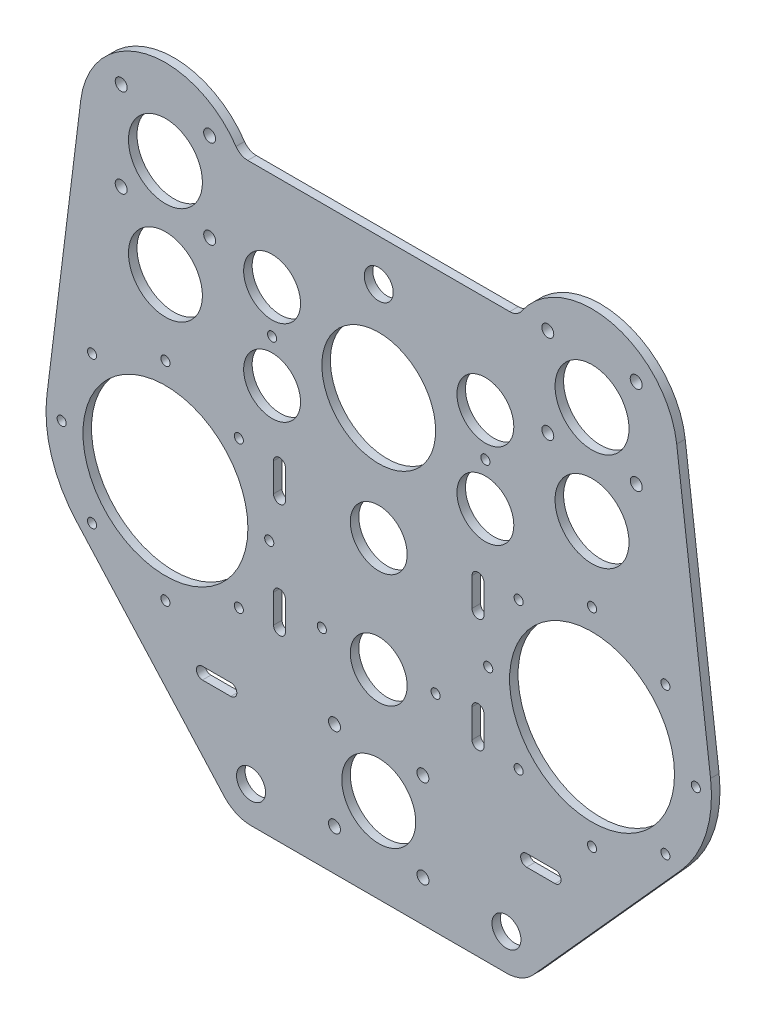
from build123d import *

# Parameters (mm, degrees)
MODEL_R             = 13
MODEL_R_2           = 5.1
MODEL_R_3           = 10
MODEL_R_4           = 20
MODEL_R_5           = 29
MODEL_R_6           = 1.6
MODEL_R_7           = 2.1
BOSS_EXTRUDE1_DEPTH = 3
CUT_EXTRUDE1_REACH  = 162.618
SKETCH1_R           = 1.6


with BuildPart() as part:
    # Model → Boss-Extrude1 (new body)
    with BuildSketch(Plane.XY):
        with BuildLine():
            Line((-44.9, -110), (0, -110))
            Line((0, -110), (44.9, -110))
            ThreePointArc((44.9, -110), (50.059264201, -108.902545418), (54.325169295, -105.800212848))
            Line((54.325169295, -105.800212848), (106.229152519, -48.084515893))
            ThreePointArc((106.229152519, -48.084515893), (115.069026633, -32.588610118), (116.679519982, -14.821427412))
            Line((116.679519982, -14.821427412), (104.771085702, 81.023096559))
            ThreePointArc((104.771085702, 81.023096559), (82.034748438, 106.48766041), (50.189310486, 94.189159448))
            ThreePointArc((50.189310486, 94.189159448), (48.393618278, 92.581052005), (46.054195567, 92))
            Line((46.054195567, 92), (0, 92))
            Line((0, 92), (-46.054195567, 92))
            ThreePointArc((-46.054195567, 92), (-48.393618278, 92.581052005), (-50.189310486, 94.189159448))
            ThreePointArc((-50.189310486, 94.189159448), (-82.034748438, 106.48766041), (-104.771085702, 81.023096559))
            Line((-104.771085702, 81.023096559), (-116.679519982, -14.821427412))
            ThreePointArc((-116.679519982, -14.821427412), (-115.069026633, -32.588610118), (-106.229152519, -48.084515893))
            Line((-106.229152519, -48.084515893), (-54.325169295, -105.800212848))
            ThreePointArc((-54.325169295, -105.800212848), (-50.059264201, -108.902545418), (-44.9, -110))
        make_face()
        with Locations((0, -80)):
            Circle(MODEL_R, mode=Mode.SUBTRACT)
        with Locations((-44.9, -97.324116139)):
            Circle(MODEL_R_2, mode=Mode.SUBTRACT)
        with Locations((44.9, -97.324116139)):
            Circle(MODEL_R_2, mode=Mode.SUBTRACT)
        with Locations((0, 77.324116139)):
            Circle(MODEL_R_2, mode=Mode.SUBTRACT)
        Circle(MODEL_R_3, mode=Mode.SUBTRACT)
        with Locations((0, -40)):
            Circle(MODEL_R_3, mode=Mode.SUBTRACT)
        with Locations((0, 42.675883861)):
            Circle(MODEL_R_4, mode=Mode.SUBTRACT)
        with Locations((-37.5, 57.675883861)):
            Circle(MODEL_R_3, mode=Mode.SUBTRACT)
        with Locations((-37.5, 27.675883861)):
            Circle(MODEL_R_3, mode=Mode.SUBTRACT)
        with Locations((37.5, 57.675883861)):
            Circle(MODEL_R_3, mode=Mode.SUBTRACT)
        with Locations((37.5, 27.675883861)):
            Circle(MODEL_R_3, mode=Mode.SUBTRACT)
        with Locations((-75, -20)):
            Circle(MODEL_R_5, mode=Mode.SUBTRACT)
        with Locations((-75, 16.5)):
            Circle(MODEL_R_6, mode=Mode.SUBTRACT)
        with Locations((-100.809397513, 5.809397513)):
            Circle(MODEL_R_6, mode=Mode.SUBTRACT)
        with Locations((-49.190602487, 5.809397513)):
            Circle(MODEL_R_6, mode=Mode.SUBTRACT)
        with Locations((-38.5, -20)):
            Circle(MODEL_R_6, mode=Mode.SUBTRACT)
        with Locations((-49.190602487, -45.809397513)):
            Circle(MODEL_R_6, mode=Mode.SUBTRACT)
        with Locations((-75, -56.5)):
            Circle(MODEL_R_6, mode=Mode.SUBTRACT)
        with Locations((-100.809397513, -45.809397513)):
            Circle(MODEL_R_6, mode=Mode.SUBTRACT)
        with Locations((-111.5, -20)):
            Circle(MODEL_R_6, mode=Mode.SUBTRACT)
        with Locations((75, -20)):
            Circle(MODEL_R_5, mode=Mode.SUBTRACT)
        with Locations((75, 16.5)):
            Circle(MODEL_R_6, mode=Mode.SUBTRACT)
        with Locations((49.190602487, 5.809397513)):
            Circle(MODEL_R_6, mode=Mode.SUBTRACT)
        with Locations((100.809397513, 5.809397513)):
            Circle(MODEL_R_6, mode=Mode.SUBTRACT)
        with Locations((111.5, -20)):
            Circle(MODEL_R_6, mode=Mode.SUBTRACT)
        with Locations((100.809397513, -45.809397513)):
            Circle(MODEL_R_6, mode=Mode.SUBTRACT)
        with Locations((75, -56.5)):
            Circle(MODEL_R_6, mode=Mode.SUBTRACT)
        with Locations((49.190602487, -45.809397513)):
            Circle(MODEL_R_6, mode=Mode.SUBTRACT)
        with Locations((38.5, -20)):
            Circle(MODEL_R_6, mode=Mode.SUBTRACT)
        with Locations((-75, 77.324116139)):
            Circle(MODEL_R, mode=Mode.SUBTRACT)
        with Locations((75, 77.324116139)):
            Circle(MODEL_R, mode=Mode.SUBTRACT)
        with Locations((-75, 42.801273872)):
            Circle(MODEL_R, mode=Mode.SUBTRACT)
        with Locations((75, 42.675883861)):
            Circle(MODEL_R, mode=Mode.SUBTRACT)
        with Locations((-59.467622393, 92.856493746)):
            Circle(MODEL_R_7, mode=Mode.SUBTRACT)
        with Locations((-90.556349186, 92.880465325)):
            Circle(MODEL_R_7, mode=Mode.SUBTRACT)
        with Locations((-90.556349186, 61.767766953)):
            Circle(MODEL_R_7, mode=Mode.SUBTRACT)
        with Locations((-59.443650814, 61.767766953)):
            Circle(MODEL_R_7, mode=Mode.SUBTRACT)
        with Locations((90.532377607, 92.856493746)):
            Circle(MODEL_R_7, mode=Mode.SUBTRACT)
        with Locations((59.443650814, 92.880465325)):
            Circle(MODEL_R_7, mode=Mode.SUBTRACT)
        with Locations((59.443650814, 61.767766953)):
            Circle(MODEL_R_7, mode=Mode.SUBTRACT)
        with Locations((90.556349186, 61.767766953)):
            Circle(MODEL_R_7, mode=Mode.SUBTRACT)
        with Locations((15.532377607, -64.467622393)):
            Circle(MODEL_R_7, mode=Mode.SUBTRACT)
        with Locations((-15.556349186, -64.443650814)):
            Circle(MODEL_R_7, mode=Mode.SUBTRACT)
        with Locations((-15.556349186, -95.556349186)):
            Circle(MODEL_R_7, mode=Mode.SUBTRACT)
        with Locations((15.556349186, -95.556349186)):
            Circle(MODEL_R_7, mode=Mode.SUBTRACT)
        with BuildLine():
            Line((-37, 5), (-37, -5))
            ThreePointArc((-37, -5), (-34.9, -7.1), (-32.8, -5))
            Line((-32.8, -5), (-32.8, 5))
            ThreePointArc((-32.8, 5), (-34.9, 7.1), (-37, 5))
        make_face(mode=Mode.SUBTRACT)
        with BuildLine():
            Line((-37, -35), (-37, -45))
            ThreePointArc((-37, -45), (-34.9, -47.1), (-32.8, -45))
            Line((-32.8, -45), (-32.8, -35))
            ThreePointArc((-32.8, -35), (-34.9, -32.9), (-37, -35))
        make_face(mode=Mode.SUBTRACT)
        with BuildLine():
            Line((37, 5), (37, -5))
            ThreePointArc((37, -5), (34.9, -7.1), (32.8, -5))
            Line((32.8, -5), (32.8, 5))
            ThreePointArc((32.8, 5), (34.9, 7.1), (37, 5))
        make_face(mode=Mode.SUBTRACT)
        with BuildLine():
            Line((37, -35), (37, -45))
            ThreePointArc((37, -45), (34.9, -47.1), (32.8, -45))
            Line((32.8, -45), (32.8, -35))
            ThreePointArc((32.8, -35), (34.9, -32.9), (37, -35))
        make_face(mode=Mode.SUBTRACT)
        with BuildLine():
            Line((-62, -70), (-52, -70))
            ThreePointArc((-52, -70), (-49.9, -72.1), (-52, -74.2))
            Line((-52, -74.2), (-62, -74.2))
            ThreePointArc((-62, -74.2), (-64.1, -72.1), (-62, -70))
        make_face(mode=Mode.SUBTRACT)
        with BuildLine():
            Line((62, -70), (52, -70))
            ThreePointArc((52, -70), (49.9, -72.1), (52, -74.2))
            Line((52, -74.2), (62, -74.2))
            ThreePointArc((62, -74.2), (64.1, -72.1), (62, -70))
        make_face(mode=Mode.SUBTRACT)
    extrude(amount=BOSS_EXTRUDE1_DEPTH)

    # Sketch1 → Cut-Extrude1 (cut, up to next)
    with BuildSketch(Plane.XY.offset(3), mode=Mode.PRIVATE) as cut_extrude1_sk1:
        with Locations((-37.5, 42.675883861)):
            Circle(SKETCH1_R)
    cut_extrude1_tool1 = extrude(cut_extrude1_sk1.sketch, amount=-CUT_EXTRUDE1_REACH, mode=Mode.PRIVATE) & part.part
    # Sketch1 → Cut-Extrude1 (cut, up to next)
    with BuildSketch(Plane.XY.offset(3), mode=Mode.PRIVATE) as cut_extrude1_sk2:
        with Locations((37.5, 42.675883861)):
            Circle(SKETCH1_R)
    cut_extrude1_tool2 = extrude(cut_extrude1_sk2.sketch, amount=-CUT_EXTRUDE1_REACH, mode=Mode.PRIVATE) & part.part
    # Sketch1 → Cut-Extrude1 (cut, up to next)
    with BuildSketch(Plane.XY.offset(3), mode=Mode.PRIVATE) as cut_extrude1_sk3:
        with Locations((-20, -37.324116139)):
            Circle(SKETCH1_R)
    cut_extrude1_tool3 = extrude(cut_extrude1_sk3.sketch, amount=-CUT_EXTRUDE1_REACH, mode=Mode.PRIVATE) & part.part
    # Sketch1 → Cut-Extrude1 (cut, up to next)
    with BuildSketch(Plane.XY.offset(3), mode=Mode.PRIVATE) as cut_extrude1_sk4:
        with Locations((20, -37.324116139)):
            Circle(SKETCH1_R)
    cut_extrude1_tool4 = extrude(cut_extrude1_sk4.sketch, amount=-CUT_EXTRUDE1_REACH, mode=Mode.PRIVATE) & part.part
    add(cut_extrude1_tool1.solids().sort_by_distance((-37.5, 42.675884, 3))[0], mode=Mode.SUBTRACT)
    add(cut_extrude1_tool2.solids().sort_by_distance((37.5, 42.675884, 3))[0], mode=Mode.SUBTRACT)
    add(cut_extrude1_tool3.solids().sort_by_distance((-20, -37.324116, 3))[0], mode=Mode.SUBTRACT)
    add(cut_extrude1_tool4.solids().sort_by_distance((20, -37.324116, 3))[0], mode=Mode.SUBTRACT)


solid = part.part
